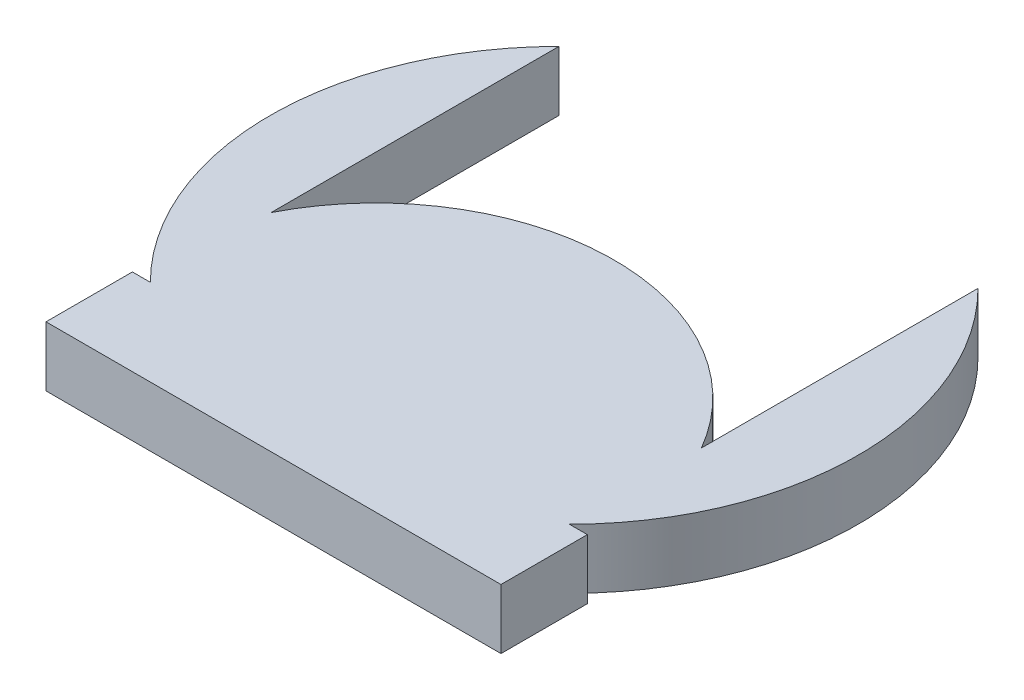
from build123d import *

# Parameters (mm, degrees)
BOSS_EXTRUDE2_DEPTH = 5
BOSS_EXTRUDE3_START = -5
BOSS_EXTRUDE3_DEPTH = 5
SKETCH5_W           = 1.5
SKETCH5_H           = 7.215071269
BOSS_EXTRUDE4_DEPTH = 5


with BuildPart() as part:
    # Sketch1 → Boss-Extrude2 (new body)
    with BuildSketch(Plane(origin=(0, 0, 0), x_dir=(1, 0, 0), z_dir=(0, 1, 0))):
        with BuildLine():
            Line((-35, 10.092006525), (-35, 34.126916803))
            ThreePointArc((-35, 34.126916803), (-42.067915891, 17.063458401), (-35, 0))
            ThreePointArc((-35, 0), (-17.5, -2.732905818), (0, 0))
            ThreePointArc((0, 0), (7.067915891, 17.063458401), (0, 34.126916803))
            Line((0, 34.126916803), (0, 11.021533442))
            ThreePointArc((0, 11.021533442), (-17.776697358, 20.975411278), (-35, 10.092006525))
        make_face()
    extrude(amount=BOSS_EXTRUDE2_DEPTH)

    # Sketch4 → Boss-Extrude3 (add)
    with BuildSketch(Plane(origin=(0, 5, 0), x_dir=(1, 0, 0), z_dir=(0, 1, 0)).offset(BOSS_EXTRUDE3_START)):
        with BuildLine():
            Line((0, 0), (0, -7.215071269))
            Line((0, -7.215071269), (-35, -7.215071269))
            Line((-35, -7.215071269), (-35, 0))
            ThreePointArc((-35, 0), (-42.067915891, 17.063458401), (-35, 34.126916803))
            Line((-35, 34.126916803), (-35, 10.092006525))
            ThreePointArc((-35, 10.092006525), (-17.776697358, 20.975411278), (0, 11.021533442))
            Line((0, 11.021533442), (0, 34.126916803))
            ThreePointArc((0, 34.126916803), (7.067915891, 17.063458401), (0, 0))
        make_face()
    extrude(amount=BOSS_EXTRUDE3_DEPTH)

    # Sketch5 → Boss-Extrude4 (add)
    with BuildSketch(Plane(origin=(0, 5, 0), x_dir=(1, 0, 0), z_dir=(0, 1, 0))):
        with Locations((-35.75, -3.607535635)):
            Rectangle(SKETCH5_W, SKETCH5_H)
        with Locations((0.75, -3.607535635)):
            Rectangle(SKETCH5_W, SKETCH5_H)
    extrude(amount=-BOSS_EXTRUDE4_DEPTH)


solid = part.part
